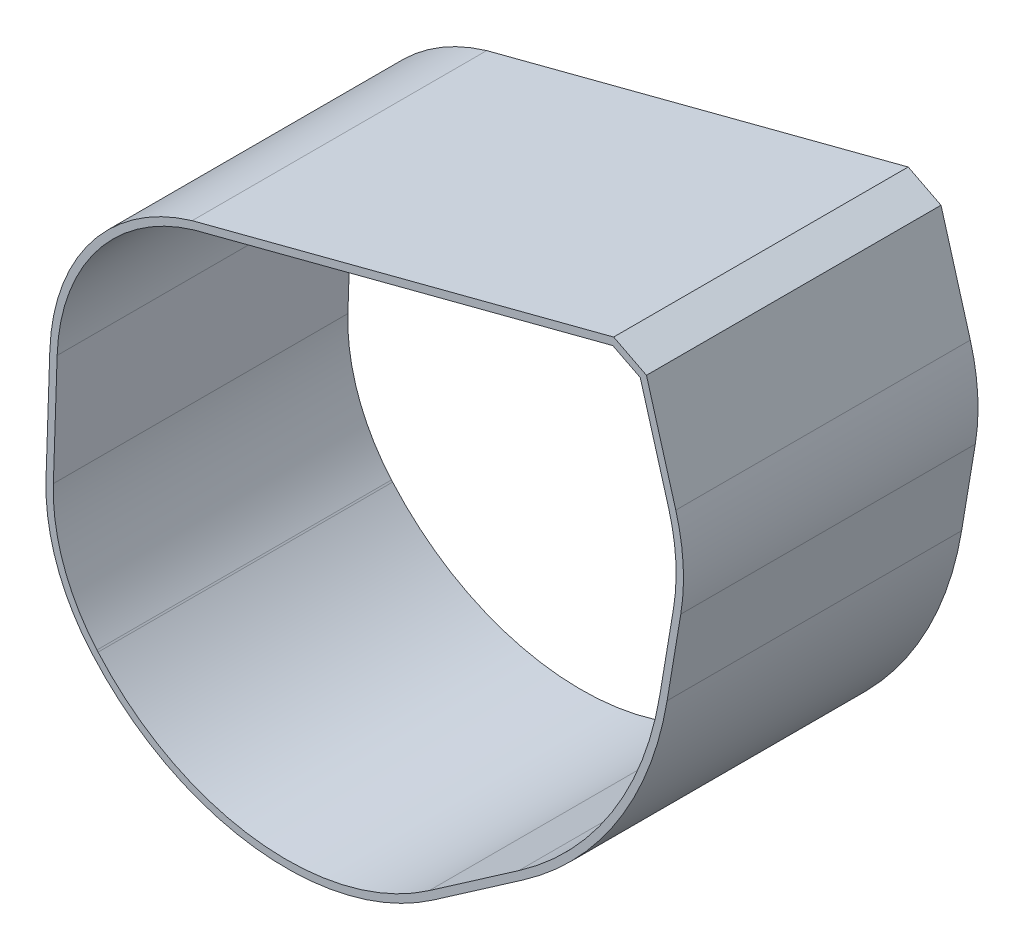
from build123d import *

# Parameters (mm, degrees)
BOSS_EXTRUDE1_DEPTH = 101.6


with BuildPart() as part:
    # Sketch1 → Boss-Extrude1 (new body)
    with BuildSketch(Plane.XY):
        with BuildLine():
            Line((51.799660555, 261.122372087), (197.186615042, 299.043929939))
            Line((197.186615042, 299.043929939), (208.509660322, 293.287113842))
            Line((208.509660322, 293.287113842), (218.620076974, 258.056123915))
            ThreePointArc((218.620076974, 258.056123915), (221.169715366, 243.040079022), (220.342179316, 227.83161282))
            Line((220.342179316, 227.83161282), (215.6257762, 199.617635489))
            ThreePointArc((215.6257762, 199.617635489), (198.699129745, 155.371015972), (165.895883475, 121.19175716))
            Line((165.895883475, 121.19175716), (135.007693071, 99.777817102))
            ThreePointArc((135.007693071, 99.777817102), (73.443869598, 84.610101156), (17.431420723, 114.321538997))
            Line((17.431420723, 114.321538997), (17.036655023, 114.773038812))
            ThreePointArc((17.036655023, 114.773038812), (5.027038746, 135.249887254), (1.376775545, 158.7063956))
            Line((1.376775545, 158.7063956), (2.687868659, 197.659197646))
            ThreePointArc((2.687868659, 197.659197646), (16.992541419, 237.323825473), (51.799660555, 261.122372087))
        make_face()
        with BuildLine():
            Line((52.480544155, 258.674987582), (196.894837031, 296.342844243))
            Line((196.894837031, 296.342844243), (206.373128662, 291.523930207))
            Line((206.373128662, 291.523930207), (216.178620917, 257.355486833))
            ThreePointArc((216.178620917, 257.355486833), (218.633828258, 242.895591751), (217.836941691, 228.250402074))
            Line((217.836941691, 228.250402074), (213.120538575, 200.036424744))
            ThreePointArc((213.120538575, 200.036424744), (196.554033533, 156.731222664), (164.448728673, 123.279182124))
            Line((164.448728673, 123.279182124), (133.560538269, 101.865242067))
            ThreePointArc((133.560538269, 101.865242067), (73.755681182, 87.130889432), (19.343587989, 115.99342905))
            Line((19.343587989, 115.99342905), (18.948822289, 116.444928865))
            ThreePointArc((18.948822289, 116.444928865), (7.419590663, 136.102703369), (3.91533799, 158.620951381))
            Line((3.91533799, 158.620951381), (5.226431104, 197.573753427))
            ThreePointArc((5.226431104, 197.573753427), (18.98894665, 235.75335118), (52.480544155, 258.674987582))
        make_face(mode=Mode.SUBTRACT)
    extrude(amount=BOSS_EXTRUDE1_DEPTH)


solid = part.part
